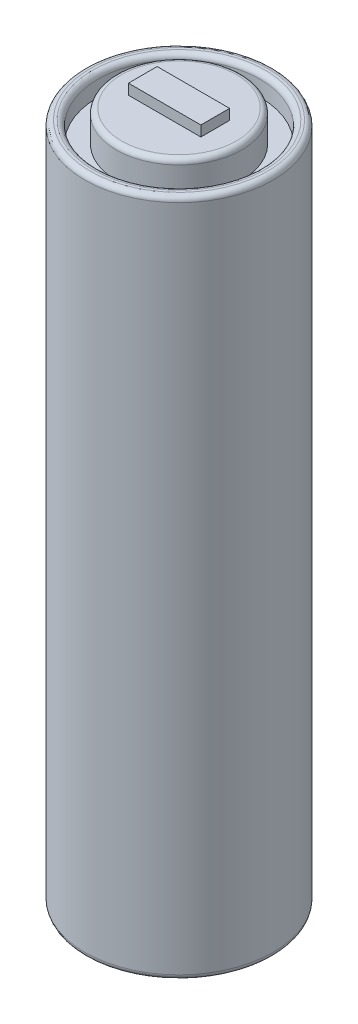
from build123d import *

# Parameters (mm, degrees)
SKETCH_1_R          = 9
EXTRUDE_1_DEPTH     = 65
SKETCH_2_R          = 7.75
SKETCH_2_R_2        = 6
CUT_EXTRUDE_1_DEPTH = 2
EXTRUDE_START       = 1
SKETCH_4_R          = 6
EXTRUDE_3_DEPTH     = 1
FILLET_1_R          = 0.5
SKETCH_3_W          = 6.932919868
SKETCH_3_H          = 2.75170262
EXTRUDE_910_DEPTH   = 1
SKETCH_5_W          = 6.932919868
SKETCH_5_H          = 2.75170262
EXTRUDE_1061_DEPTH  = 1


with BuildPart() as part:
    # 草图1 → 凸台-拉伸1 (new body)
    with BuildSketch(Plane(origin=(0, 0, 0), x_dir=(1, 0, 0), z_dir=(0, 1, 0))):
        with Locations(Location((0, 0, 0), (0, 0, 270))):
            Circle(SKETCH_1_R)
    extrude(amount=EXTRUDE_1_DEPTH)

    # 草图2 → 切除-拉伸1 (cut)
    with BuildSketch(Plane(origin=(0, 65, 0), x_dir=(1, 0, 0), z_dir=(0, 1, 0))):
        with Locations(Location((0, 0, 0), (0, 0, 270))):
            Circle(SKETCH_2_R)
        with Locations(Location((0, 0, 0), (0, 0, 270))):
            Circle(SKETCH_2_R_2, mode=Mode.SUBTRACT)
    extrude(amount=-CUT_EXTRUDE_1_DEPTH, mode=Mode.SUBTRACT)

    # 草图4 → 凸台-拉伸3 (add)
    with BuildSketch(Plane(origin=(0, 65, 0), x_dir=(1, 0, 0), z_dir=(0, 1, 0)).offset(EXTRUDE_START)):
        with Locations(Location((0, 0, 0), (0, 0, 270))):
            Circle(SKETCH_4_R)
    extrude(amount=-EXTRUDE_3_DEPTH)

    # 圆角1
    fillet_1_edges = [part.edges().sort_by_distance(p)[0] for p in [
        (0, 66, -6),
        (0, 0, -9),
        (0, 65, -9),
        (0, 65, -7.75),
    ]]
    fillet(fillet_1_edges, radius=FILLET_1_R)

    # 草图3 → Extrude 910 (add)
    with BuildSketch(Plane.XZ):
        Rectangle(SKETCH_3_W, SKETCH_3_H)
    extrude(amount=EXTRUDE_910_DEPTH)

    # 草图5 → Extrude 1061 (add)
    with BuildSketch(Plane(origin=(0, 66, 0), x_dir=(1, 0, 0), z_dir=(0, 1, 0))):
        Rectangle(SKETCH_5_W, SKETCH_5_H)
    extrude(amount=EXTRUDE_1061_DEPTH)


solid = part.part
